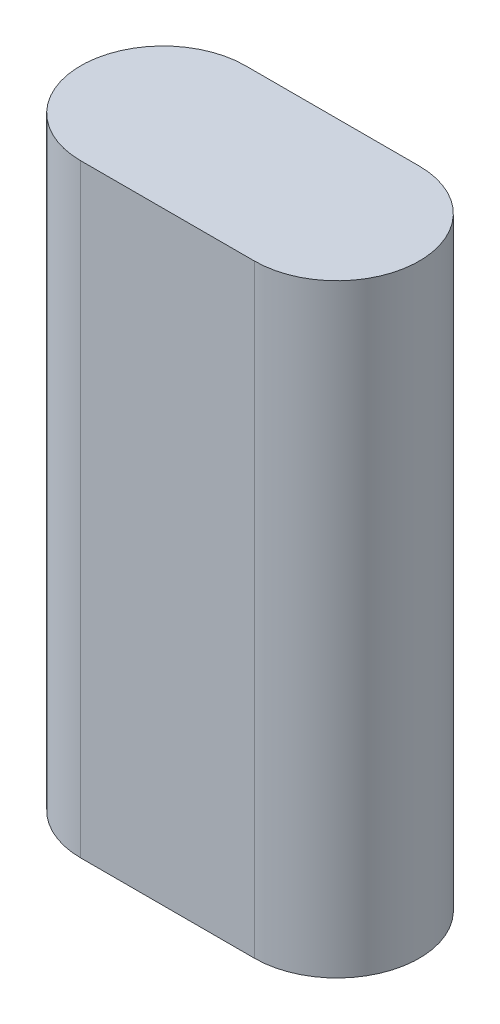
from build123d import *

# Parameters (mm, degrees)
EXTRUDE_1_DEPTH = 66


with BuildPart() as part:
    # 草图1 → 凸台-拉伸1 (new body)
    with BuildSketch(Plane(origin=(0, 0, 0), x_dir=(1, 0, 0), z_dir=(0, 1, 0))):
        with BuildLine():
            Line((-9.5, 9), (9.5, 9))
            ThreePointArc((9.5, 9), (18.5, 0), (9.5, -9))
            Line((9.5, -9), (-9.5, -9))
            ThreePointArc((-9.5, -9), (-18.5, 0), (-9.5, 9))
        make_face()
    extrude(amount=EXTRUDE_1_DEPTH)


solid = part.part
